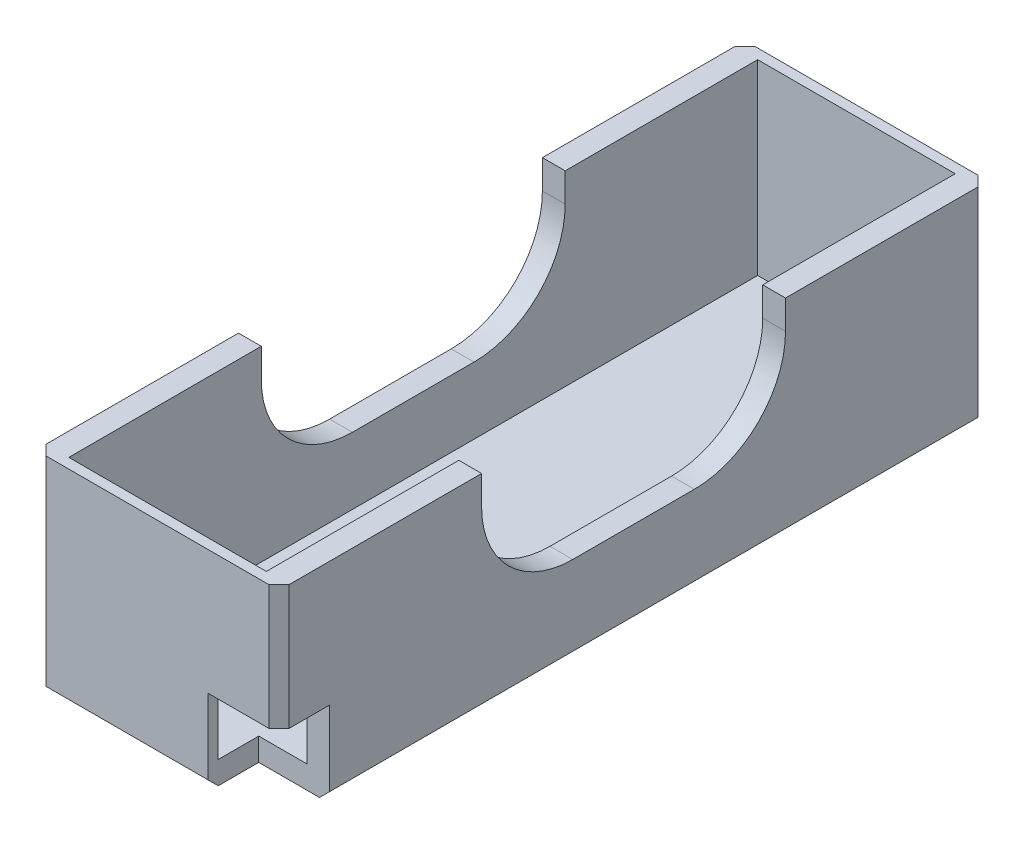
from build123d import *

# Parameters (mm, degrees)
SKETCH1_W               = 24
SKETCH1_H               = 70
BOSS_EXTRUDE1_DEPTH     = 20.7
SKETCH2_W               = 19.5
SKETCH2_H               = 68
CUT_EXTRUDE1_DEPTH      = 18.45
CUT_EXTRUDE2_DEPTH      = 48.217475578
CUT_EXTRUDE2_DEPTH_BACK = 48.217475578
SKETCH4_W               = 30
SKETCH4_H               = 11.85
FILLET1_R               = 9
SKETCH5_W               = 7
SKETCH5_H               = 8.41
CUT_EXTRUDE3_DEPTH      = 5
CHAMFER1_SIZE           = 1


with BuildPart() as part:
    # Sketch1 → Boss-Extrude1 (new body)
    with BuildSketch(Plane(origin=(0, 0, 0), x_dir=(1, 0, 0), z_dir=(0, 1, 0))):
        Rectangle(SKETCH1_W, SKETCH1_H)
    extrude(amount=BOSS_EXTRUDE1_DEPTH)

    # Sketch2 → Cut-Extrude1 (cut)
    with BuildSketch(Plane(origin=(0, 20.7, 0), x_dir=(1, 0, 0), z_dir=(0, 1, 0))):
        Rectangle(SKETCH2_W, SKETCH2_H)
    extrude(amount=-CUT_EXTRUDE1_DEPTH, mode=Mode.SUBTRACT)

    # Sketch4 → Cut-Extrude2 (cut, two sides: drawn at the far end of the back side and taken through both)
    with BuildSketch(Plane.ZY.offset(12).offset(-CUT_EXTRUDE2_DEPTH_BACK)):
        with Locations((0, 14.775)):
            Rectangle(SKETCH4_W, SKETCH4_H)
    extrude(amount=CUT_EXTRUDE2_DEPTH + CUT_EXTRUDE2_DEPTH_BACK, mode=Mode.SUBTRACT)

    # Fillet1
    fillet1_edges = [part.edges().sort_by_distance(p)[0] for p in [
        (-10.875, 8.85, -15),
        (10.875, 8.85, -15),
        (-10.875, 8.85, 15),
        (10.875, 8.85, 15),
    ]]
    fillet(fillet1_edges, radius=FILLET1_R)

    # Sketch5 → Cut-Extrude3 (cut)
    with BuildSketch(Plane.XY.offset(35)):
        with Locations((8.5, 4.205)):
            Rectangle(SKETCH5_W, SKETCH5_H)
    extrude(amount=-CUT_EXTRUDE3_DEPTH, mode=Mode.SUBTRACT)

    # Chamfer1
    chamfer1_edges = [part.edges().sort_by_distance(p)[0] for p in [
        (0, 0, -35),
        (-3.5, 0, 35),
        (-12, 0, 0),
        (-12, 10.35, -35),
        (12, 10.35, -35),
        (12, 14.555, 35),
        (-12, 10.35, 35),
        (12, 0, -2.5),
    ]]
    chamfer(chamfer1_edges, length=CHAMFER1_SIZE)


solid = part.part
